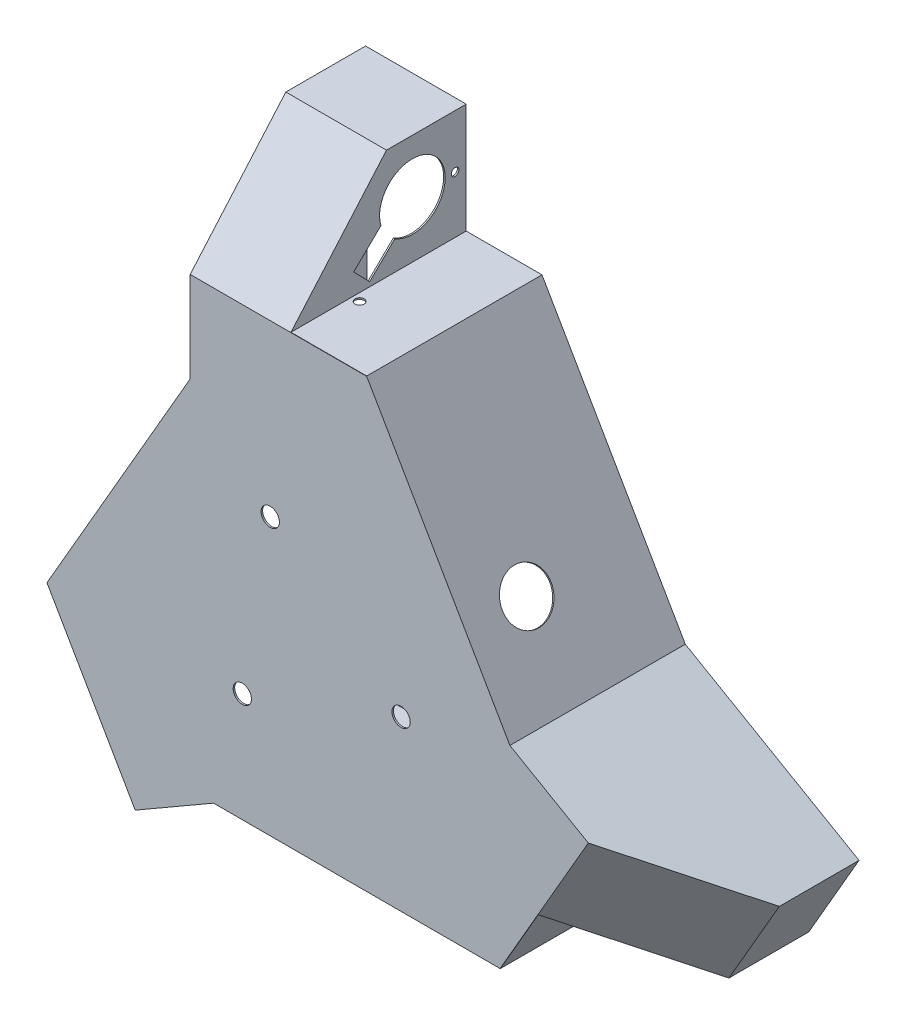
from build123d import *

# Parameters (mm, degrees)
SKETCH_1_R           = 255
EXTRUDE_1_DEPTH      = 115
CUT_EXTRUDE_1_DEPTH  = 379.516842426
CUT_EXTRUDE_START    = -140
CUT_EXTRUDE_2_DEPTH  = 140
CUT_EXTRUDE_3_DEPTH  = 140
CUT_EXTRUDE_4_DEPTH  = 140
CUT_EXTRUDE_5_DEPTH  = 140
SHELL_1_T            = -1
SKETCH_7_R           = 21.5
CUT_EXTRUDE_6_DEPTH  = 10
CUT_EXTRUDE_7_DEPTH  = 10
CUT_EXTRUDE_8_DEPTH  = 10
SKETCH_10_R          = 6
CUT_EXTRUDE_9_DEPTH  = 10
SKETCH_11_R          = 2.5
CUT_EXTRUDE_10_DEPTH = 10
SKETCH_13_R          = 2.5
CUT_EXTRUDE_11_DEPTH = 10
SKETCH_12_R          = 2.5
CUT_EXTRUDE_12_DEPTH = 10
SKETCH_16_R          = 16
CUT_EXTRUDE_13_DEPTH = 4.5
CUT_EXTRUDE_14_DEPTH = 4.5
SKETCH_18_R          = 3
CUT_EXTRUDE_15_DEPTH = 4.5
SKETCH_19_R          = 3
CUT_EXTRUDE_16_DEPTH = 4.5
SKETCH_20_R          = 3
CUT_EXTRUDE_17_DEPTH = 4.5


with BuildPart() as part:
    # 草图1 → 拉伸1 (new body)
    with BuildSketch(Plane.XY):
        Circle(SKETCH_1_R)
    extrude(amount=EXTRUDE_1_DEPTH)

    # 草图2 → 切除-拉伸1 (cut, through all)
    with BuildSketch(Plane.XY.offset(115)):
        with BuildLine():
            Line((-75, 243.721152139), (-75, 112.168783649))
            Line((-75, 112.168783649), (-149.641016151, -17.113248654))
            Line((-149.641016151, -17.113248654), (-168.970965418, -50.593702892))
            Line((-168.970965418, -50.593702892), (-144.135940052, -93.609228634))
            Line((-144.135940052, -93.609228634), (-216.198889893, -135.214792124))
            ThreePointArc((-216.198889893, -135.214792124), (-238.950435932, 89.037571663), (-75, 243.721152139))
        make_face()
        with BuildLine():
            Line((134.641016151, 8.867513459), (248.568709192, -56.908670786))
            ThreePointArc((248.568709192, -56.908670786), (196.584016918, 162.418361931), (-9, 254.841126979))
            Line((-9, 254.841126979), (-9, 171.63))
            Line((-9, 171.63), (40.670050733, 171.63))
            Line((40.670050733, 171.63), (60, 138.149545762))
            Line((60, 138.149545762), (134.641016151, 8.867513459))
        make_face()
        with BuildLine():
            Line((-173.568709192, -186.812481353), (-59.641016151, -121.036297108))
            Line((-59.641016151, -121.036297108), (89.641016151, -121.036297108))
            Line((89.641016151, -121.036297108), (128.300914685, -121.036297108))
            Line((128.300914685, -121.036297108), (153.135940052, -78.020771366))
            Line((153.135940052, -78.020771366), (225.198889893, -119.626334856))
            ThreePointArc((225.198889893, -119.626334856), (42.366419014, -251.455933595), (-173.568709192, -186.812481353))
        make_face()
    extrude(amount=-CUT_EXTRUDE_1_DEPTH, mode=Mode.SUBTRACT)

    # 草图3 → 切除-拉伸2 (cut)
    with BuildSketch(Plane.XY.offset(115).offset(CUT_EXTRUDE_START)):
        with BuildLine():
            Line((225.198889893, -119.626334856), (215.568709192, -114.066347435))
            Line((215.568709192, -114.066347435), (248.568709192, -56.908670786))
            ThreePointArc((248.568709192, -56.908670786), (238.950435932, -89.037571663), (225.198889893, -119.626334856))
        make_face()
        with BuildLine():
            Line((-9, 254.841126979), (-9, 243.721152139))
            Line((-9, 243.721152139), (-75, 243.721152139))
            ThreePointArc((-75, 243.721152139), (-42.366419014, 251.455933595), (-9, 254.841126979))
        make_face()
        with BuildLine():
            Line((-216.198889893, -135.214792124), (-206.568709192, -129.654804704))
            Line((-206.568709192, -129.654804704), (-173.568709192, -186.812481353))
            ThreePointArc((-173.568709192, -186.812481353), (-196.584016918, -162.418361931), (-216.198889893, -135.214792124))
        make_face()
    extrude(amount=CUT_EXTRUDE_2_DEPTH, mode=Mode.SUBTRACT)

    # 草图4 → 切除-拉伸3 (cut)
    with BuildSketch(Plane(origin=(37.5, -64.951905284, 0), x_dir=(0.8660254037844386, 0.5000000000000002, 0), z_dir=(0.5000000000000002, -0.8660254037844386, 0))):
        Polygon((-171.521152139, 115), (-243.721152139, 115), (-243.721152139, 52.281731212), align=None)
    extrude(amount=-CUT_EXTRUDE_3_DEPTH, mode=Mode.SUBTRACT)

    # 草图5 → 切除-拉伸4 (cut)
    with BuildSketch(Plane(origin=(37.5, 64.951905284, 0), x_dir=(-0.8660254037844387, 0.4999999999999999, 0), z_dir=(0.4999999999999999, 0.8660254037844387, 0))):
        Polygon((-171.521152139, 115), (-243.721152139, 115), (-243.721152139, 52.281731212), align=None)
    extrude(amount=-CUT_EXTRUDE_4_DEPTH, mode=Mode.SUBTRACT)

    # 草图6 → 切除-拉伸5 (cut)
    with BuildSketch(Plane.ZY.offset(75)):
        Polygon((115, 171.521152139), (115, 243.721152139), (52.281731212, 243.721152139), align=None)
    extrude(amount=-CUT_EXTRUDE_5_DEPTH, mode=Mode.SUBTRACT)

    # 抽壳1
    shell_1_openings = [part.faces().sort_by_distance(p)[0] for p in [
        (0, 0, 0),
    ]]
    offset(amount=SHELL_1_T, openings=shell_1_openings, kind=Kind.INTERSECTION)

    # 草图7 → 切除-拉伸6 (cut)
    with BuildSketch(Plane(origin=(-9, 0, 0), x_dir=(0, 0, -1), z_dir=(1, 0, 0))):
        with Locations(Location((-35.3, 208.831152139, 0), (0, 0, 90))):
            Circle(SKETCH_7_R)
    extrude(amount=-CUT_EXTRUDE_6_DEPTH, mode=Mode.SUBTRACT)

    # 草图8 → 切除-拉伸7 (cut)
    with BuildSketch(Plane(origin=(4.5, 7.794228634, 0), x_dir=(0.8660254037844387, -0.5, 0), z_dir=(-0.5, -0.8660254037844387, 0))):
        with BuildLine():
            Line((202.443951117, 55.829336646), (184.789521579, 73.483766184))
            Line((184.789521579, 73.483766184), (174.182919861, 62.877164466))
            Line((174.182919861, 62.877164466), (190.509645151, 46.550439177))
            ThreePointArc((190.509645151, 46.550439177), (222.027914903, 18.326625187), (202.443951117, 55.829336646))
        make_face()
    extrude(amount=-CUT_EXTRUDE_7_DEPTH, mode=Mode.SUBTRACT)

    # 草图9 → 切除-拉伸8 (cut)
    with BuildSketch(Plane(origin=(4.5, -7.794228634, 0), x_dir=(-0.8660254037844388, -0.4999999999999996, 0), z_dir=(-0.4999999999999996, 0.8660254037844388, 0))):
        with BuildLine():
            Line((202.443951117, 55.829336646), (184.789521579, 73.483766184))
            Line((184.789521579, 73.483766184), (174.182919861, 62.877164466))
            Line((174.182919861, 62.877164466), (190.509645151, 46.550439177))
            ThreePointArc((190.509645151, 46.550439177), (222.027914903, 18.326625187), (202.443951117, 55.829336646))
        make_face()
    extrude(amount=-CUT_EXTRUDE_8_DEPTH, mode=Mode.SUBTRACT)

    # 草图10 → 切除-拉伸9 (cut)
    with BuildSketch(Plane.XY.offset(115)):
        with Locations((-22.5, 60.111069989)):
            Circle(SKETCH_10_R)
        with Locations((-40.807713659, -49.54110658)):
            Circle(SKETCH_10_R)
        with Locations((63.307713659, -10.56996341)):
            Circle(SKETCH_10_R)
    extrude(amount=-CUT_EXTRUDE_9_DEPTH, mode=Mode.SUBTRACT)

    # 草图11 → 切除-拉伸10 (cut)
    with BuildSketch(Plane(origin=(-9, 0, 0), x_dir=(0, 0, -1), z_dir=(1, 0, 0))):
        with Locations(Location((-7.30433866, 208.832756681, 0), (0, 0, 90))):
            Circle(SKETCH_11_R)
    extrude(amount=-CUT_EXTRUDE_10_DEPTH, mode=Mode.SUBTRACT)

    # 草图13 → 切除-拉伸11 (cut)
    with BuildSketch(Plane(origin=(4.5, -7.794228634, 0), x_dir=(-0.8660254037844389, -0.4999999999999995, 0), z_dir=(-0.4999999999999995, 0.8660254037844389, 0))):
        with Locations((208.832756681, 7.30433866)):
            Circle(SKETCH_13_R)
    extrude(amount=-CUT_EXTRUDE_11_DEPTH, mode=Mode.SUBTRACT)

    # 草图12 → 切除-拉伸12 (cut)
    with BuildSketch(Plane(origin=(4.5, 7.794228634, 0), x_dir=(0.8660254037844386, -0.4999999999999999, 0), z_dir=(-0.49999999999999994, -0.8660254037844387, 0))):
        with Locations((208.832756681, 7.30433866)):
            Circle(SKETCH_12_R)
    extrude(amount=-CUT_EXTRUDE_12_DEPTH, mode=Mode.SUBTRACT)

    # 草图16 → 切除-拉伸13 (cut)
    with BuildSketch(Plane(origin=(104.820508076, 60.518148554, 0), x_dir=(0, 0, -1), z_dir=(0.8660254037844385, 0.5000000000000004, 0))):
        with Locations(Location((-75, -1.699085315, 0), (0, 0, 90))):
            Circle(SKETCH_16_R)
    extrude(amount=-CUT_EXTRUDE_13_DEPTH, mode=Mode.SUBTRACT)

    # 草图17 → 切除-拉伸14 (cut)
    with BuildSketch(Plane(origin=(-9, 0, 0), x_dir=(0, 0, -1), z_dir=(1, 0, 0))):
        with BuildLine():
            Line((-55.907885828, 202.70211945), (-73.782506819, 185.270662567))
            Line((-73.782506819, 185.270662567), (-63.309864805, 174.531772063))
            Line((-63.309864805, 174.531772063), (-46.779507597, 190.652293392))
            ThreePointArc((-46.779507597, 190.652293392), (-18.162328595, 221.813841337), (-55.907885828, 202.70211945))
        make_face()
    extrude(amount=-CUT_EXTRUDE_14_DEPTH, mode=Mode.SUBTRACT)

    # 草图18 → 切除-拉伸15 (cut)
    with BuildSketch(Plane(origin=(0, 171.63, 0), x_dir=(-1, 0, 0), z_dir=(0, 1, 0))):
        with Locations(Location((4, 74.905446684, 0), (0, 0, 90))):
            Circle(SKETCH_18_R)
    extrude(amount=-CUT_EXTRUDE_15_DEPTH, mode=Mode.SUBTRACT)

    # 草图19 → 切除-拉伸16 (cut)
    with BuildSketch(Plane(origin=(148.635940052, -85.815, 0), x_dir=(0, 0, -1), z_dir=(0.8660254037844388, -0.49999999999999983, 0))):
        with Locations(Location((-74.905446684, 4, 0), (0, 0, 90))):
            Circle(SKETCH_19_R)
    extrude(amount=-CUT_EXTRUDE_16_DEPTH, mode=Mode.SUBTRACT)

    # 草图20 → 切除-拉伸17 (cut)
    with BuildSketch(Plane(origin=(-148.635940052, -85.815, 0), x_dir=(0, 0, 1), z_dir=(-0.866025403784438, -0.5000000000000009, 0))):
        with Locations(Location((74.905446684, -4, 0), (0, 0, 270))):
            Circle(SKETCH_20_R)
    extrude(amount=-CUT_EXTRUDE_17_DEPTH, mode=Mode.SUBTRACT)


solid = part.part
